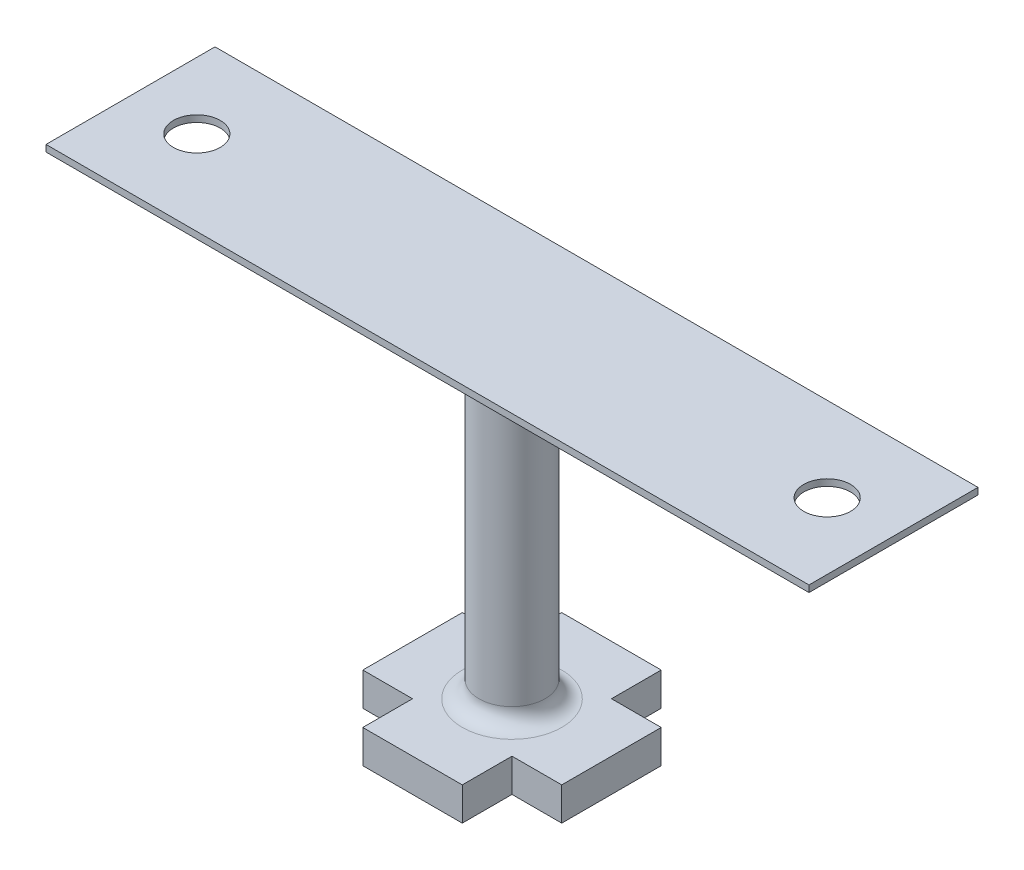
from build123d import *

# Parameters (mm, degrees)
SKETCH1_W           = 230.12
SKETCH1_H           = 50.974909876
SKETCH1_R           = 7.058173785
BOSS_EXTRUDE1_DEPTH = 2
SKETCH2_R           = 10
BOSS_EXTRUDE2_DEPTH = 100
BOSS_EXTRUDE3_DEPTH = 10
FILLET1_R           = 5


with BuildPart() as part:
    # Sketch1 → Boss-Extrude1 (new body)
    with BuildSketch(Plane(origin=(0, 0, 0), x_dir=(1, 0, 0), z_dir=(0, 1, 0))):
        Rectangle(SKETCH1_W, SKETCH1_H)
        with Locations(Location((-95.06, 0, 0), (0, 0, 270))):
            Circle(SKETCH1_R, mode=Mode.SUBTRACT)
        with Locations(Location((95.06, 0, 0), (0, 0, 270))):
            Circle(SKETCH1_R, mode=Mode.SUBTRACT)
    extrude(amount=BOSS_EXTRUDE1_DEPTH)

    # Sketch2 → Boss-Extrude2 (add)
    with BuildSketch(Plane(origin=(0, 2, 0), x_dir=(1, 0, 0), z_dir=(0, 1, 0))):
        with Locations(Location((0, 0, 0), (0, 0, 270))):
            Circle(SKETCH2_R)
    extrude(amount=-BOSS_EXTRUDE2_DEPTH)

    # Sketch3 → Boss-Extrude3 (add)
    with BuildSketch(Plane(origin=(0, -98, 0), x_dir=(-1, 0, 0), z_dir=(0, -1, 0))):
        Polygon((15, 15), (30, 15), (30, -15), (15, -15), (15, -30), (-15, -30), (-15, -15), (-30, -15), (-30, 15), (-15, 15), (-15, 30), (15, 30), align=None)
    extrude(amount=BOSS_EXTRUDE3_DEPTH)

    # Fillet1
    fillet1_edges = [part.edges().sort_by_distance(p)[0] for p in [
        (0, 0, -10),
        (0, -98, -10),
    ]]
    fillet(fillet1_edges, radius=FILLET1_R)


solid = part.part
